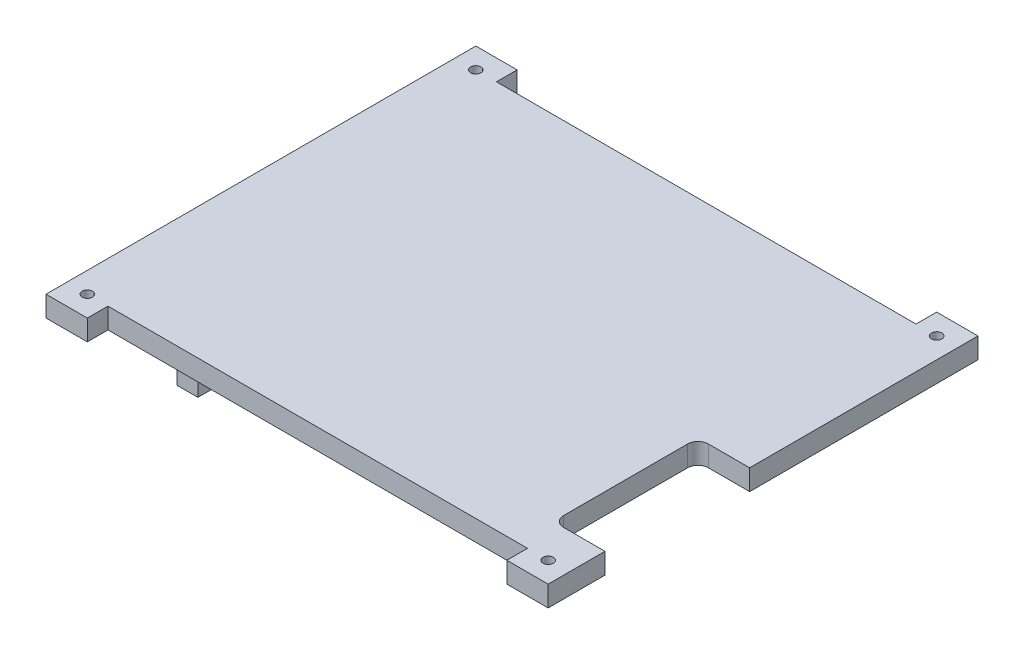
from build123d import *

# Parameters (mm, degrees)
SKETCH1_R           = 0.5
BOSS_EXTRUDE1_DEPTH = 2
CUT_EXTRUDE1_DEPTH  = 2
FILLET1_R           = 1
SKETCH4_W           = 2
SKETCH4_H           = 16.2
BOSS_EXTRUDE2_DEPTH = 12


with BuildPart() as part:
    # Sketch1 → Boss-Extrude1 (new body)
    # profile 1 of 3: a face of its own
    with BuildSketch(Plane(origin=(0, -1346.908376945, 0), x_dir=(1, 0, 0), z_dir=(0, 1, 0))):
        Polygon((-1025.832273514, 2000), (-1025.832273514, 1981.9), (-1023.832273514, 1981.9), (-1023.832273514, 2004), (-1027.832273514, 2004), (-1027.832273514, 2002), (-1068.432273514, 2002), (-1068.432273514, 2004), (-1072.432273514, 2004), (-1072.432273514, 1991.5), (-1070.432273514, 1991.5), (-1070.432273514, 2000), align=None)
        with Locations(Location((-1070.432273514, 2002, 0), (0, 0, 270))):
            Circle(SKETCH1_R, mode=Mode.SUBTRACT)
        with Locations(Location((-1025.832273514, 2002, 0), (0, 0, 270))):
            Circle(SKETCH1_R, mode=Mode.SUBTRACT)
    # profile 2 of 3: a face of its own
    with BuildSketch(Plane(origin=(0, -1346.908376945, 0), x_dir=(1, 0, 0), z_dir=(0, 1, 0))):
        Polygon((-1023.832273514, 1981.9), (-1023.832273514, 1967.9), (-1025.832273514, 1967.9), (-1025.832273514, 1966.4), (-1070.432273514, 1966.4), (-1070.432273514, 1974.9), (-1072.432273514, 1974.9), (-1072.432273514, 1991.5), (-1070.432273514, 1991.5), (-1070.432273514, 2000), (-1025.832273514, 2000), (-1025.832273514, 1981.9), align=None)
    # profile 3 of 3: a face of its own
    with BuildSketch(Plane(origin=(0, -1346.908376945, 0), x_dir=(1, 0, 0), z_dir=(0, 1, 0))):
        Polygon((-1027.832273514, 1962.4), (-1023.832273514, 1962.4), (-1023.832273514, 1967.9), (-1025.832273514, 1967.9), (-1025.832273514, 1966.4), (-1070.432273514, 1966.4), (-1070.432273514, 1974.9), (-1072.432273514, 1974.9), (-1072.432273514, 1962.4), (-1068.432273514, 1962.4), (-1068.432273514, 1964.4), (-1027.832273514, 1964.4), align=None)
        with Locations(Location((-1025.832273514, 1964.4, 0), (0, 0, 270))):
            Circle(SKETCH1_R, mode=Mode.SUBTRACT)
        with Locations(Location((-1070.432273514, 1964.4, 0), (0, 0, 270))):
            Circle(SKETCH1_R, mode=Mode.SUBTRACT)
    extrude(amount=BOSS_EXTRUDE1_DEPTH)

    # Sketch3 → Cut-Extrude1 (cut)
    with BuildSketch(Plane(origin=(0, -1344.908376945, 0), x_dir=(1, 0, 0), z_dir=(0, 1, 0))):
        Polygon((-1028.832273514, 1967.9), (-1025.832273514, 1967.9), (-1023.832273514, 1967.9), (-1023.832273514, 1981.9), (-1025.832273514, 1981.9), (-1028.832273514, 1981.9), align=None)
    extrude(amount=-CUT_EXTRUDE1_DEPTH, mode=Mode.SUBTRACT)

    # Fillet1
    fillet1_edges = [part.edges().sort_by_distance(p)[0] for p in [
        (-1028.832273514, -1345.908376945, -1967.9),
        (-1028.832273514, -1345.908376945, -1981.9),
    ]]
    fillet(fillet1_edges, radius=FILLET1_R)

    # Sketch4 → Boss-Extrude2 (add)
    with BuildSketch(Plane.XZ.offset(1346.908376945)):
        with Locations((-1071.432273514, -1983.2)):
            Rectangle(SKETCH4_W, SKETCH4_H)
    extrude(amount=BOSS_EXTRUDE2_DEPTH)


solid = part.part
